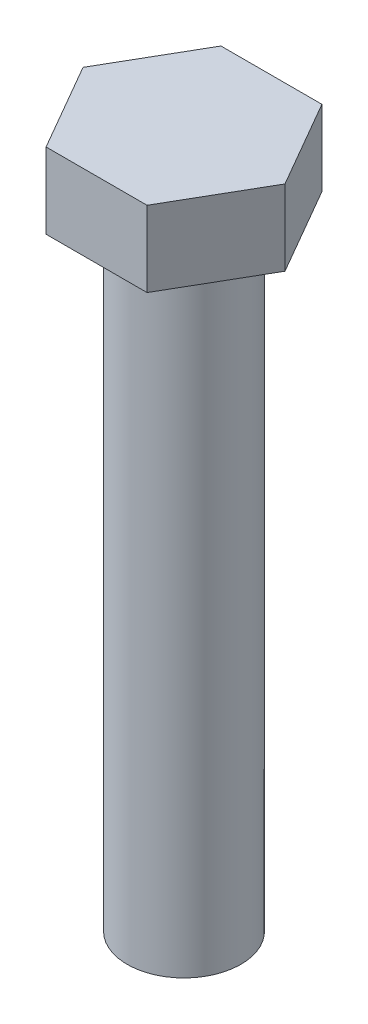
from build123d import *

# Parameters (mm, degrees)
BOSS_EXTRUDE1_DEPTH = 6.1722
SKETCH2_R           = 4.6437235
BOSS_EXTRUDE2_DEPTH = 50.8


with BuildPart() as part:
    # Sketch1 → Boss-Extrude1 (new body)
    with BuildSketch(Plane(origin=(0, 0, 0), x_dir=(1, 0, 0), z_dir=(0, 1, 0))):
        Polygon((8.241559623, 0), (4.120779811, 7.1374), (-4.120779811, 7.1374), (-8.241559623, 0), (-4.120779811, -7.1374), (4.120779811, -7.1374), align=None)
    extrude(amount=BOSS_EXTRUDE1_DEPTH)

    # Sketch2 → Boss-Extrude2 (add)
    with BuildSketch(Plane.XZ):
        with Locations(Location((0, 0, 0), (0, 0, 270))):
            Circle(SKETCH2_R)
    extrude(amount=BOSS_EXTRUDE2_DEPTH)


solid = part.part
